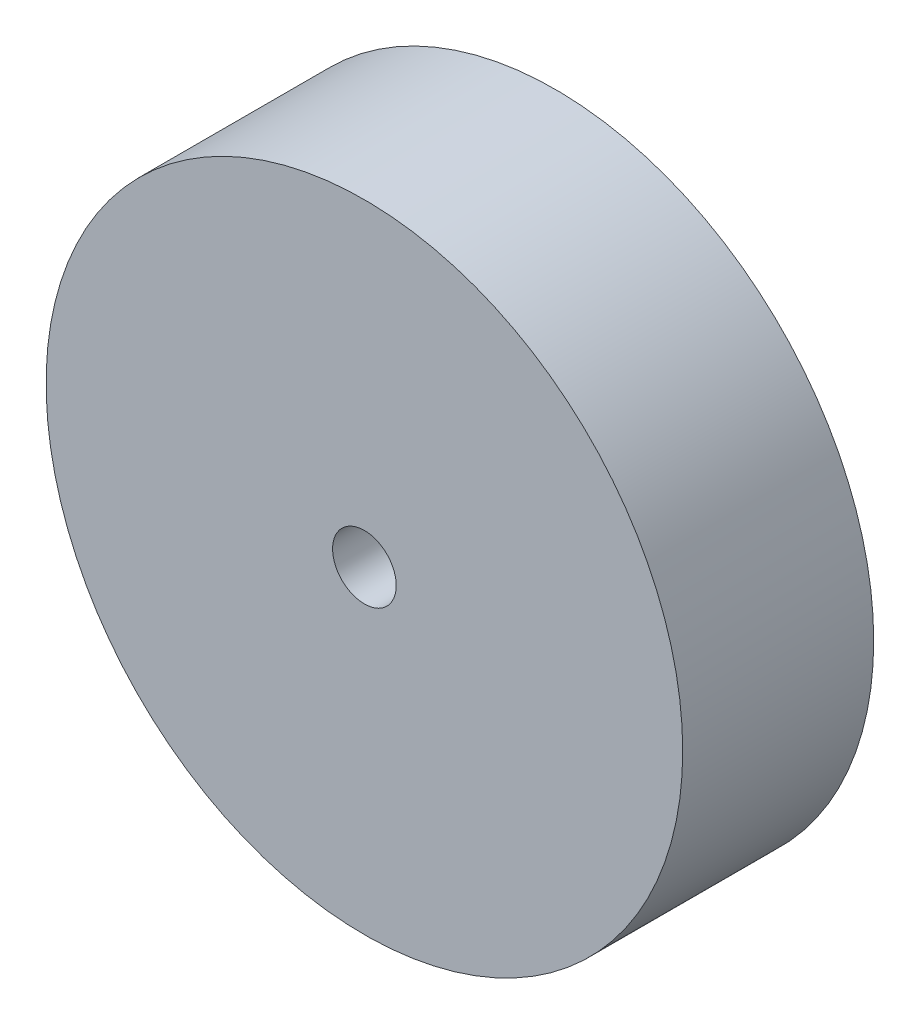
from build123d import *

# Parameters (mm, degrees)
SKETCH1_R           = 25
SKETCH1_R_2         = 2.5
BOSS_EXTRUDE1_DEPTH = 15


with BuildPart() as part:
    # Sketch1 → Boss-Extrude1 (new body)
    with BuildSketch(Plane.XY):
        Circle(SKETCH1_R)
        Circle(SKETCH1_R_2, mode=Mode.SUBTRACT)
    extrude(amount=BOSS_EXTRUDE1_DEPTH)


solid = part.part
